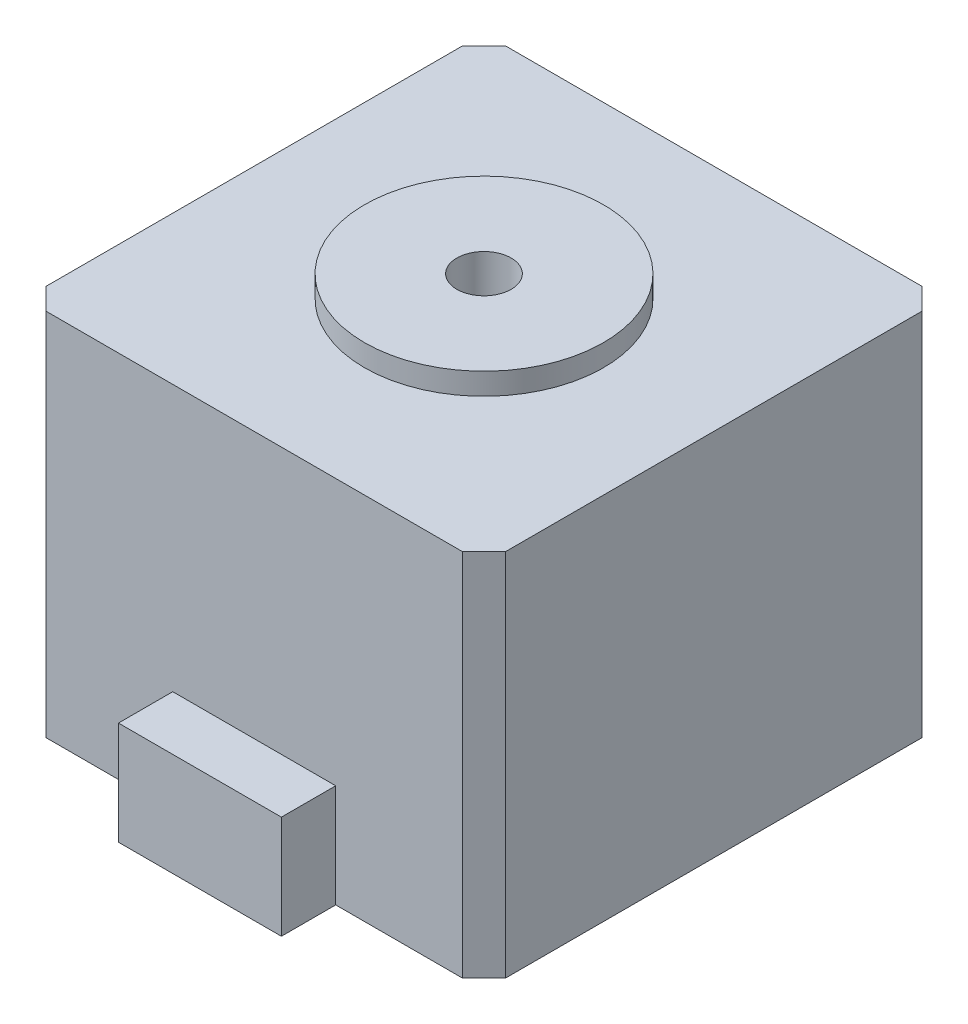
from build123d import *

# Parameters (mm, degrees)
SKETCH1_W           = 42.3
SKETCH1_H           = 42.3
BOSS_EXTRUDE1_DEPTH = 34
CHAMFER2_SIZE       = 2
SKETCH2_R           = 11
BOSS_EXTRUDE2_DEPTH = 2
SKETCH3_R           = 2.5
CUT_EXTRUDE2_DEPTH  = 20
SKETCH5_W           = 15
SKETCH5_H           = 9.5
BOSS_EXTRUDE4_DEPTH = 5


with BuildPart() as part:
    # Sketch1 → Boss-Extrude1 (new body)
    with BuildSketch(Plane(origin=(0, 0, 0), x_dir=(1, 0, 0), z_dir=(0, 1, 0))):
        with Locations((21.15, 21.15)):
            Rectangle(SKETCH1_W, SKETCH1_H)
    extrude(amount=BOSS_EXTRUDE1_DEPTH)

    # Chamfer2
    chamfer2_edges = [part.edges().sort_by_distance(p)[0] for p in [
        (0, 17, -42.3),
        (42.3, 17, -42.3),
        (42.3, 17, 0),
        (0, 17, 0),
    ]]
    chamfer(chamfer2_edges, length=CHAMFER2_SIZE)

    # Sketch2 → Boss-Extrude2 (add)
    with BuildSketch(Plane(origin=(0, 34, 0), x_dir=(1, 0, 0), z_dir=(0, 1, 0))):
        with Locations(Location((21.15, 21.15, 0), (0, 0, 270))):
            Circle(SKETCH2_R)
    extrude(amount=BOSS_EXTRUDE2_DEPTH)

    # Sketch3 → Cut-Extrude2 (cut)
    with BuildSketch(Plane(origin=(0, 36, 0), x_dir=(1, 0, 0), z_dir=(0, 1, 0))):
        with Locations(Location((21.15, 21.15, 0), (0, 0, 270))):
            Circle(SKETCH3_R)
    extrude(amount=-CUT_EXTRUDE2_DEPTH, mode=Mode.SUBTRACT)

    # Sketch5 → Boss-Extrude4 (add)
    with BuildSketch(Plane.XY):
        with Locations((21.15, 4.75)):
            Rectangle(SKETCH5_W, SKETCH5_H)
    extrude(amount=BOSS_EXTRUDE4_DEPTH)


solid = part.part
